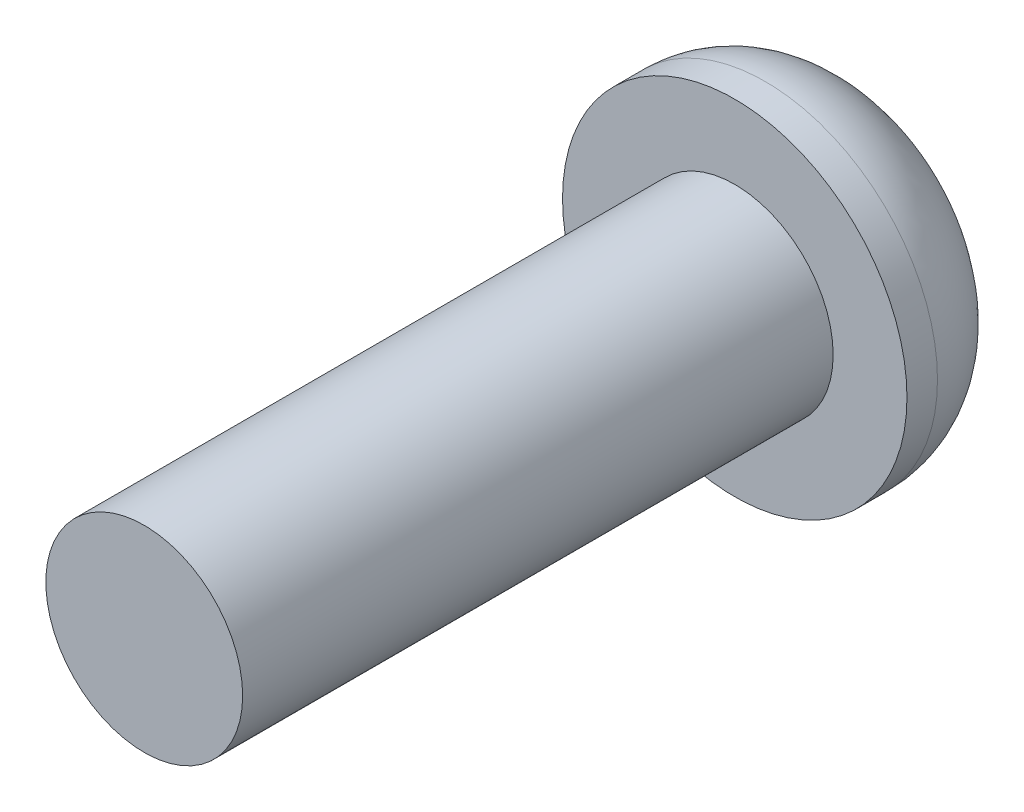
from build123d import *

# Parameters (mm, degrees)
SKETCH_1_R      = 1
EXTRUDE_1_DEPTH = 6
SKETCH_2_R      = 1.75
EXTRUDE_2_DEPTH = 1.31
FILLET_1_R      = 1


with BuildPart() as part:
    # 草图1 → 凸台-拉伸1 (new body)
    with BuildSketch(Plane.XY):
        Circle(SKETCH_1_R)
    extrude(amount=EXTRUDE_1_DEPTH)

    # 草图2 → 凸台-拉伸2 (add)
    with BuildSketch(Plane(origin=(0, 0, 0), x_dir=(-1, 0, 0), z_dir=(0, 0, -1))):
        Circle(SKETCH_2_R)
    extrude(amount=EXTRUDE_2_DEPTH)

    # 圆角1
    fillet_1_edges = [part.edges().sort_by_distance(p)[0] for p in [
        (1.75, 0, -1.31),
    ]]
    fillet(fillet_1_edges, radius=FILLET_1_R)


solid = part.part
